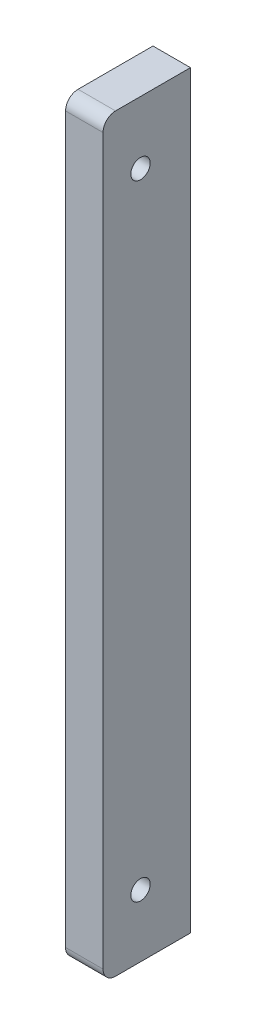
from build123d import *

# Parameters (mm, degrees)
SKETCH1_W           = 14
SKETCH1_H           = 120
SKETCH1_R           = 1.55
BOSS_EXTRUDE1_DEPTH = 6
FILLET1_R           = 2


with BuildPart() as part:
    # Sketch1 → Boss-Extrude1 (new body)
    with BuildSketch(Plane(origin=(0, 0, 0), x_dir=(0, 0, -1), z_dir=(1, 0, 0))):
        with Locations((-7, 0)):
            Rectangle(SKETCH1_W, SKETCH1_H)
        with Locations((-8, 50)):
            Circle(SKETCH1_R, mode=Mode.SUBTRACT)
        with Locations(Location((-8, -50, 0), (0, 0, 180))):
            Circle(SKETCH1_R, mode=Mode.SUBTRACT)
    extrude(amount=BOSS_EXTRUDE1_DEPTH)

    # Fillet1
    fillet1_edges = [part.edges().sort_by_distance(p)[0] for p in [
        (3, -60, 14),
        (3, 60, 14),
    ]]
    fillet(fillet1_edges, radius=FILLET1_R)


solid = part.part
